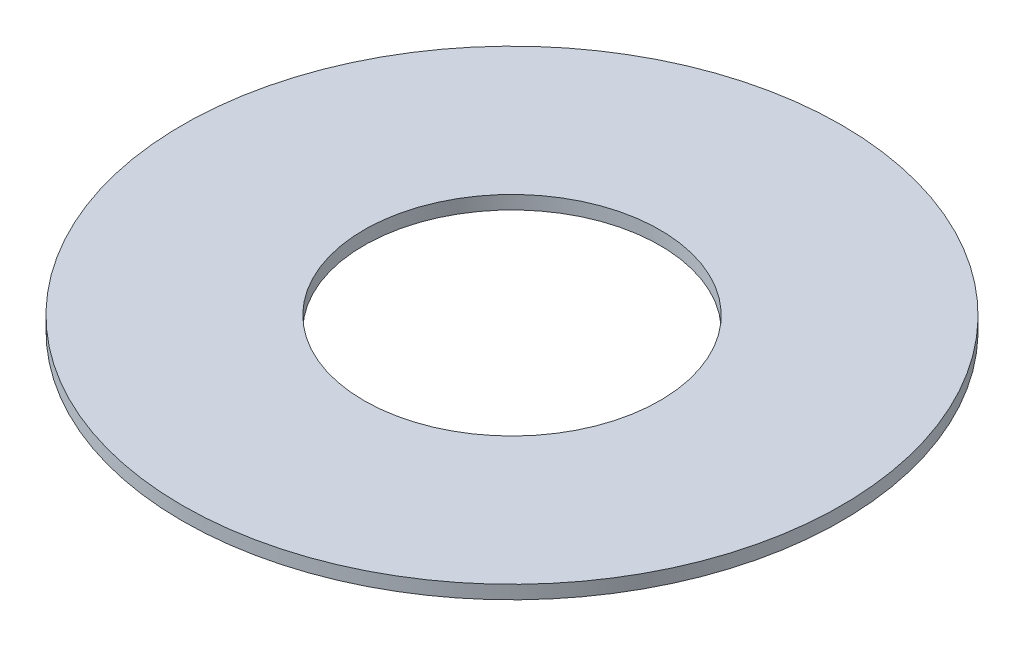
from build123d import *

# Parameters (mm, degrees)
SKETCH1_R           = 49
SKETCH1_R_2         = 22
BOSS_EXTRUDE1_DEPTH = 2


with BuildPart() as part:
    # Sketch1 → Boss-Extrude1 (new body)
    with BuildSketch(Plane(origin=(0, 0, 0), x_dir=(1, 0, 0), z_dir=(0, 1, 0))):
        with Locations(Location((0, 0, 0), (0, 0, 270))):
            Circle(SKETCH1_R)
        with Locations(Location((0, 0, 0), (0, 0, 270))):
            Circle(SKETCH1_R_2, mode=Mode.SUBTRACT)
    extrude(amount=BOSS_EXTRUDE1_DEPTH)


solid = part.part
